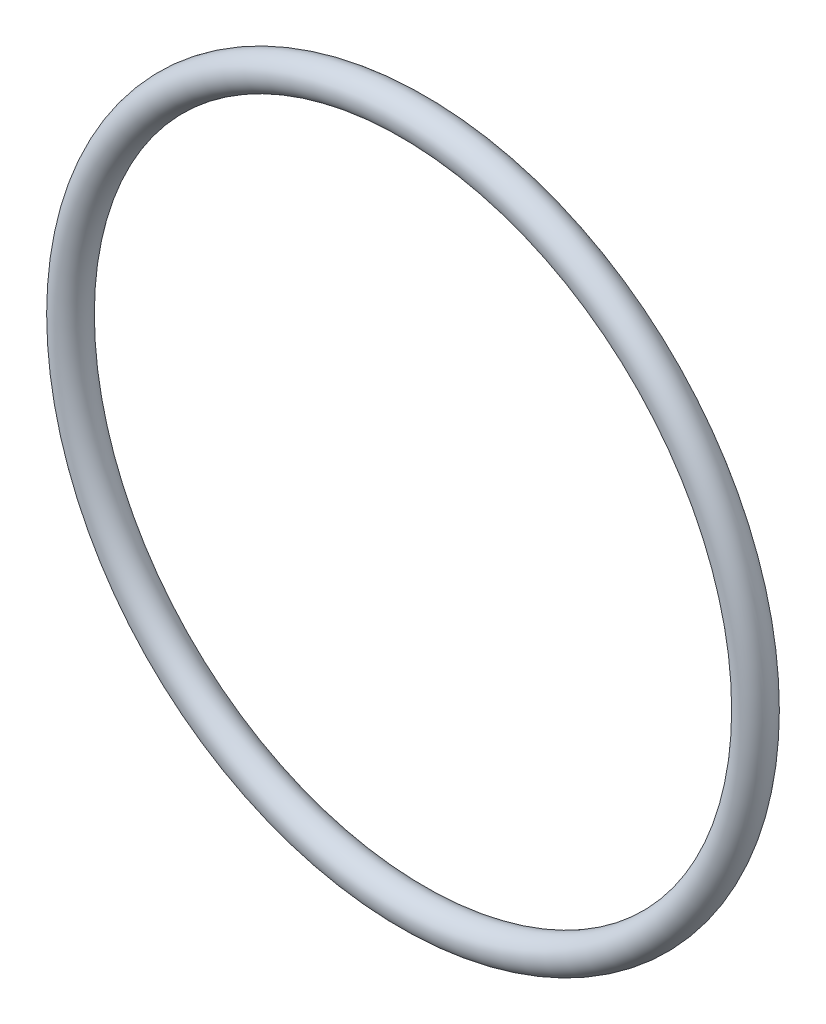
from build123d import *

# Parameters (mm, degrees)
SKETCH1_R = 1.3081


with BuildPart() as part:
    # Sketch1 → Revolve1 (revolve)
    with BuildSketch(Plane(origin=(0, 0, 0), x_dir=(0, -1, 0), z_dir=(1, 0, 0)), mode=Mode.PRIVATE) as revolve1_sk:
        with Locations((26.543, 0)):
            Circle(SKETCH1_R)
    revolve(revolve1_sk.sketch.rotate(Axis((0, 0, 1.3081), (0, 0, -1)), 270), axis=Axis((0, 0, 1.3081), (0, 0, -1)))


solid = part.part
